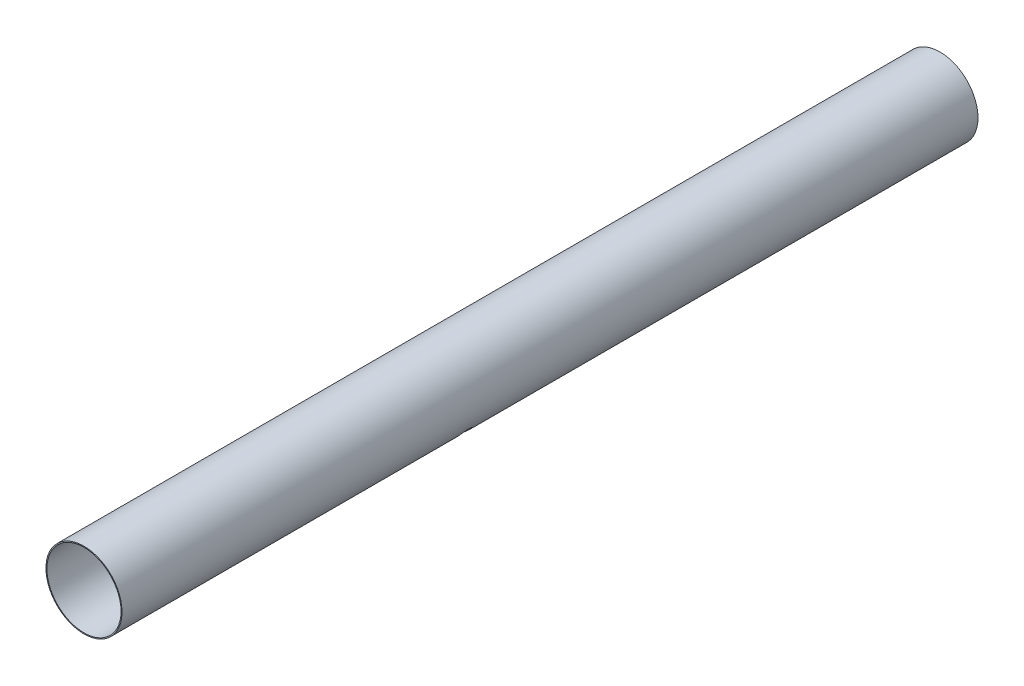
from build123d import *

# Parameters (mm, degrees)
SKETCH1_R           = 78.2
SKETCH1_R_2         = 76.2
BOSS_EXTRUDE1_DEPTH = 1760
SKETCH5_R           = 15
CUT_EXTRUDE2_DEPTH  = 1764.471145213


with BuildPart() as part:
    # Sketch1 → Boss-Extrude1 (new body)
    with BuildSketch(Plane.XY):
        Circle(SKETCH1_R)
        Circle(SKETCH1_R_2, mode=Mode.SUBTRACT)
    extrude(amount=BOSS_EXTRUDE1_DEPTH)

    # Sketch5 → Cut-Extrude2 (cut, through all)
    with BuildSketch(Plane(origin=(0, 0, 0), x_dir=(0, 0, -1), z_dir=(0.7071067811865489, -0.7071067811865462, 0))):
        with Locations(Location((-1034.89, 0, 0), (0, 0, 270))):
            Circle(SKETCH5_R)
    extrude(amount=CUT_EXTRUDE2_DEPTH, mode=Mode.SUBTRACT)


solid = part.part
